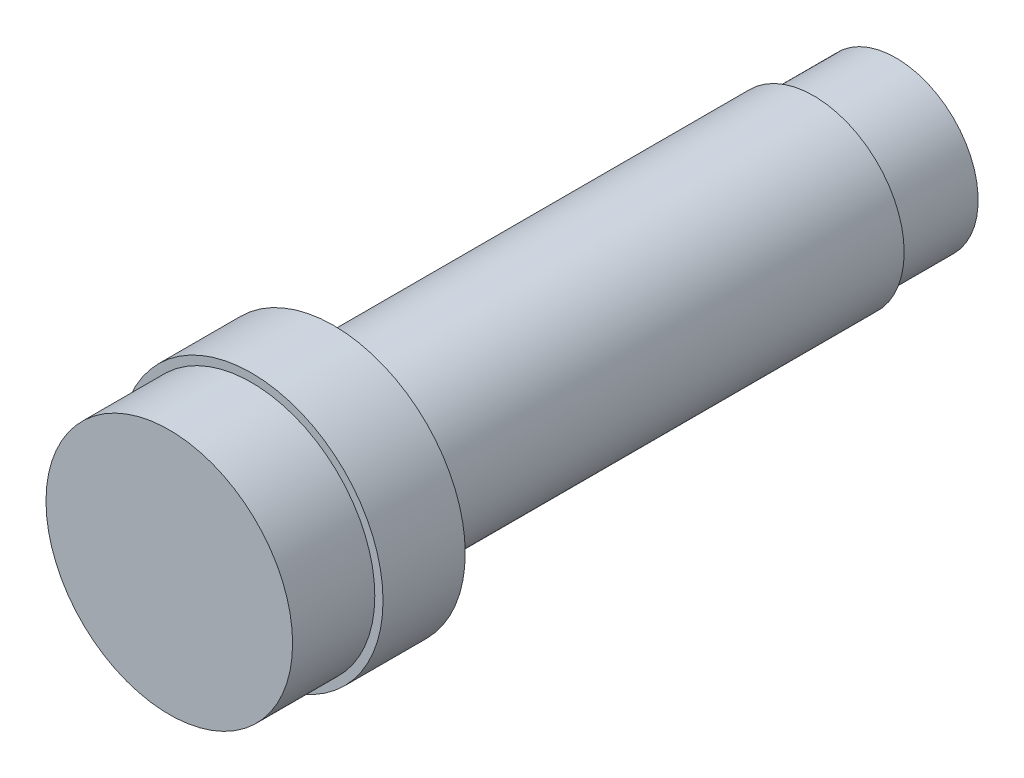
from build123d import *

# Parameters (mm, degrees)
SKETCH_1_R      = 5.5
EXTRUDE_1_DEPTH = 34.2
SKETCH_2_R      = 8
EXTRUDE_2_DEPTH = 5
SKETCH_3_R      = 7.5
EXTRUDE_3_DEPTH = 5
SKETCH_5_R      = 5
EXTRUDE_4_DEPTH = 5


with BuildPart() as part:
    # ｽｹｯﾁ1 → ﾎﾞｽ - 押し出し1 (new body)
    with BuildSketch(Plane.XY):
        Circle(SKETCH_1_R)
    extrude(amount=EXTRUDE_1_DEPTH)

    # ｽｹｯﾁ2 → ﾎﾞｽ - 押し出し2 (add)
    with BuildSketch(Plane.XY.offset(34.2)):
        Circle(SKETCH_2_R)
    extrude(amount=-EXTRUDE_2_DEPTH)

    # ｽｹｯﾁ3 → ﾎﾞｽ - 押し出し3 (add)
    with BuildSketch(Plane.XY.offset(34.2)):
        Circle(SKETCH_3_R)
    extrude(amount=EXTRUDE_3_DEPTH)

    # ｽｹｯﾁ5 → ﾎﾞｽ - 押し出し4 (add)
    with BuildSketch(Plane(origin=(0, 0, 0), x_dir=(-1, 0, 0), z_dir=(0, 0, -1))):
        Circle(SKETCH_5_R)
    extrude(amount=EXTRUDE_4_DEPTH)


solid = part.part
